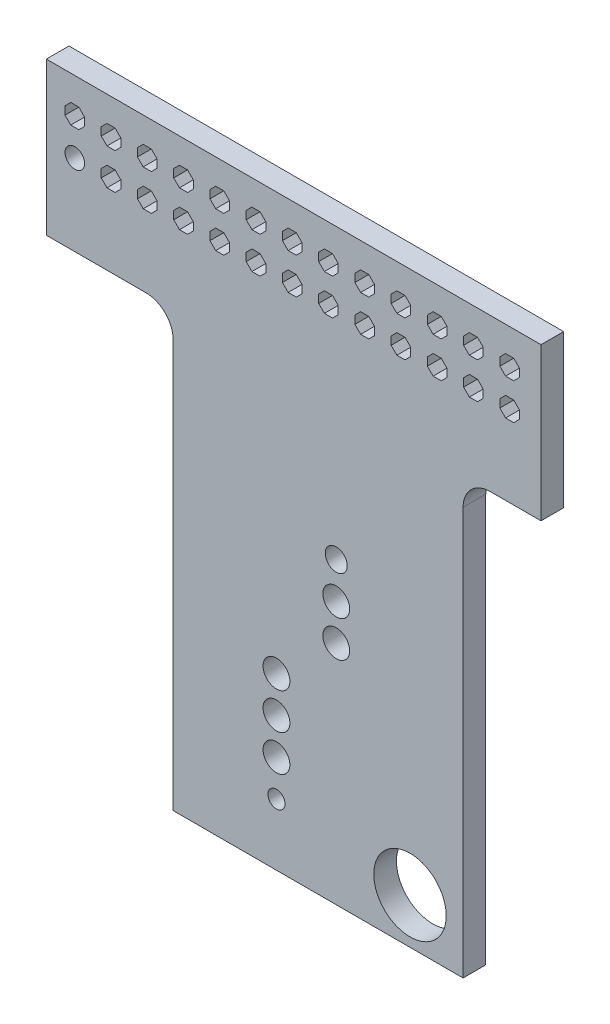
from build123d import *

# Parameters (mm, degrees)
MODEL_R             = 0.599509025
MODEL_R_2           = 0.77087645
MODEL_R_3           = 0.6858
MODEL_R_4           = 0.9398
MODEL_R_5           = 2.54
BOSS_EXTRUDE1_DEPTH = 1.5875


with BuildPart() as part:
    # Model → Boss-Extrude1 (new body)
    with BuildSketch(Plane.XY):
        with BuildLine():
            Line((8.89, 0), (29.21, 0))
            Line((29.21, 0), (29.21, 28.575))
            ThreePointArc((29.21, 28.575), (29.767961582, 29.922038418), (31.115, 30.48))
            Line((31.115, 30.48), (34.671, 30.48))
            Line((34.671, 30.48), (34.671, 41.1734))
            Line((34.671, 41.1734), (0, 41.1734))
            Line((0, 41.1734), (0, 30.48))
            Line((0, 30.48), (6.985, 30.48))
            ThreePointArc((6.985, 30.48), (8.332038418, 29.922038418), (8.89, 28.575))
            Line((8.89, 28.575), (8.89, 0))
        make_face()
        with Locations((16.129, 4.318)):
            Circle(MODEL_R, mode=Mode.SUBTRACT)
        with Locations((20.32, 20.955)):
            Circle(MODEL_R_2, mode=Mode.SUBTRACT)
        with Locations((1.9939, 36.1696)):
            Circle(MODEL_R_3, mode=Mode.SUBTRACT)
        with Locations((20.32, 18.415)):
            Circle(MODEL_R_4, mode=Mode.SUBTRACT)
        with Locations((20.32, 15.875)):
            Circle(MODEL_R_4, mode=Mode.SUBTRACT)
        with Locations((16.129, 6.858)):
            Circle(MODEL_R_4, mode=Mode.SUBTRACT)
        with Locations((16.129, 9.398)):
            Circle(MODEL_R_4, mode=Mode.SUBTRACT)
        with Locations((16.129, 11.938)):
            Circle(MODEL_R_4, mode=Mode.SUBTRACT)
        with Locations((25.4889, 3.175)):
            Circle(MODEL_R_5, mode=Mode.SUBTRACT)
        Polygon((1.3081, 38.425532039), (1.3081, 38.993667961), (1.709832039, 39.3954), (2.277967961, 39.3954), (2.6797, 38.993667961), (2.6797, 38.425532039), (2.277967961, 38.0238), (1.709832039, 38.0238), align=None, mode=Mode.SUBTRACT)
        Polygon((3.8481, 35.885532039), (3.8481, 36.453667961), (4.249832039, 36.8554), (4.817967961, 36.8554), (5.2197, 36.453667961), (5.2197, 35.885532039), (4.817967961, 35.4838), (4.249832039, 35.4838), align=None, mode=Mode.SUBTRACT)
        Polygon((3.8481, 38.425532039), (3.8481, 38.993667961), (4.249832039, 39.3954), (4.817967961, 39.3954), (5.2197, 38.993667961), (5.2197, 38.425532039), (4.817967961, 38.0238), (4.249832039, 38.0238), align=None, mode=Mode.SUBTRACT)
        Polygon((6.3881, 35.885532039), (6.3881, 36.453667961), (6.789832039, 36.8554), (7.357967961, 36.8554), (7.7597, 36.453667961), (7.7597, 35.885532039), (7.357967961, 35.4838), (6.789832039, 35.4838), align=None, mode=Mode.SUBTRACT)
        Polygon((6.3881, 38.425532039), (6.3881, 38.993667961), (6.789832039, 39.3954), (7.357967961, 39.3954), (7.7597, 38.993667961), (7.7597, 38.425532039), (7.357967961, 38.0238), (6.789832039, 38.0238), align=None, mode=Mode.SUBTRACT)
        Polygon((8.9281, 35.885532039), (8.9281, 36.453667961), (9.329832039, 36.8554), (9.897967961, 36.8554), (10.2997, 36.453667961), (10.2997, 35.885532039), (9.897967961, 35.4838), (9.329832039, 35.4838), align=None, mode=Mode.SUBTRACT)
        Polygon((8.9281, 38.425532039), (8.9281, 38.993667961), (9.329832039, 39.3954), (9.897967961, 39.3954), (10.2997, 38.993667961), (10.2997, 38.425532039), (9.897967961, 38.0238), (9.329832039, 38.0238), align=None, mode=Mode.SUBTRACT)
        Polygon((11.4681, 35.885532039), (11.4681, 36.453667961), (11.869832039, 36.8554), (12.437967961, 36.8554), (12.8397, 36.453667961), (12.8397, 35.885532039), (12.437967961, 35.4838), (11.869832039, 35.4838), align=None, mode=Mode.SUBTRACT)
        Polygon((11.4681, 38.425532039), (11.4681, 38.993667961), (11.869832039, 39.3954), (12.437967961, 39.3954), (12.8397, 38.993667961), (12.8397, 38.425532039), (12.437967961, 38.0238), (11.869832039, 38.0238), align=None, mode=Mode.SUBTRACT)
        Polygon((14.0081, 35.885532039), (14.0081, 36.453667961), (14.409832039, 36.8554), (14.977967961, 36.8554), (15.3797, 36.453667961), (15.3797, 35.885532039), (14.977967961, 35.4838), (14.409832039, 35.4838), align=None, mode=Mode.SUBTRACT)
        Polygon((14.0081, 38.425532039), (14.0081, 38.993667961), (14.409832039, 39.3954), (14.977967961, 39.3954), (15.3797, 38.993667961), (15.3797, 38.425532039), (14.977967961, 38.0238), (14.409832039, 38.0238), align=None, mode=Mode.SUBTRACT)
        Polygon((16.5481, 35.885532039), (16.5481, 36.453667961), (16.949832039, 36.8554), (17.517967961, 36.8554), (17.9197, 36.453667961), (17.9197, 35.885532039), (17.517967961, 35.4838), (16.949832039, 35.4838), align=None, mode=Mode.SUBTRACT)
        Polygon((16.5481, 38.425532039), (16.5481, 38.993667961), (16.949832039, 39.3954), (17.517967961, 39.3954), (17.9197, 38.993667961), (17.9197, 38.425532039), (17.517967961, 38.0238), (16.949832039, 38.0238), align=None, mode=Mode.SUBTRACT)
        Polygon((19.0881, 35.885532039), (19.0881, 36.453667961), (19.489832039, 36.8554), (20.057967961, 36.8554), (20.4597, 36.453667961), (20.4597, 35.885532039), (20.057967961, 35.4838), (19.489832039, 35.4838), align=None, mode=Mode.SUBTRACT)
        Polygon((19.0881, 38.425532039), (19.0881, 38.993667961), (19.489832039, 39.3954), (20.057967961, 39.3954), (20.4597, 38.993667961), (20.4597, 38.425532039), (20.057967961, 38.0238), (19.489832039, 38.0238), align=None, mode=Mode.SUBTRACT)
        Polygon((21.6281, 35.885532039), (21.6281, 36.453667961), (22.029832039, 36.8554), (22.597967961, 36.8554), (22.9997, 36.453667961), (22.9997, 35.885532039), (22.597967961, 35.4838), (22.029832039, 35.4838), align=None, mode=Mode.SUBTRACT)
        Polygon((21.6281, 38.425532039), (21.6281, 38.993667961), (22.029832039, 39.3954), (22.597967961, 39.3954), (22.9997, 38.993667961), (22.9997, 38.425532039), (22.597967961, 38.0238), (22.029832039, 38.0238), align=None, mode=Mode.SUBTRACT)
        Polygon((24.1681, 35.885532039), (24.1681, 36.453667961), (24.569832039, 36.8554), (25.137967961, 36.8554), (25.5397, 36.453667961), (25.5397, 35.885532039), (25.137967961, 35.4838), (24.569832039, 35.4838), align=None, mode=Mode.SUBTRACT)
        Polygon((24.1681, 38.425532039), (24.1681, 38.993667961), (24.569832039, 39.3954), (25.137967961, 39.3954), (25.5397, 38.993667961), (25.5397, 38.425532039), (25.137967961, 38.0238), (24.569832039, 38.0238), align=None, mode=Mode.SUBTRACT)
        Polygon((26.7081, 35.885532039), (26.7081, 36.453667961), (27.109832039, 36.8554), (27.677967961, 36.8554), (28.0797, 36.453667961), (28.0797, 35.885532039), (27.677967961, 35.4838), (27.109832039, 35.4838), align=None, mode=Mode.SUBTRACT)
        Polygon((26.7081, 38.425532039), (26.7081, 38.993667961), (27.109832039, 39.3954), (27.677967961, 39.3954), (28.0797, 38.993667961), (28.0797, 38.425532039), (27.677967961, 38.0238), (27.109832039, 38.0238), align=None, mode=Mode.SUBTRACT)
        Polygon((29.2481, 35.885532039), (29.2481, 36.453667961), (29.649832039, 36.8554), (30.217967961, 36.8554), (30.6197, 36.453667961), (30.6197, 35.885532039), (30.217967961, 35.4838), (29.649832039, 35.4838), align=None, mode=Mode.SUBTRACT)
        Polygon((29.2481, 38.425532039), (29.2481, 38.993667961), (29.649832039, 39.3954), (30.217967961, 39.3954), (30.6197, 38.993667961), (30.6197, 38.425532039), (30.217967961, 38.0238), (29.649832039, 38.0238), align=None, mode=Mode.SUBTRACT)
        Polygon((31.7881, 35.885532039), (31.7881, 36.453667961), (32.189832039, 36.8554), (32.757967961, 36.8554), (33.1597, 36.453667961), (33.1597, 35.885532039), (32.757967961, 35.4838), (32.189832039, 35.4838), align=None, mode=Mode.SUBTRACT)
        Polygon((31.7881, 38.425532039), (31.7881, 38.993667961), (32.189832039, 39.3954), (32.757967961, 39.3954), (33.1597, 38.993667961), (33.1597, 38.425532039), (32.757967961, 38.0238), (32.189832039, 38.0238), align=None, mode=Mode.SUBTRACT)
    extrude(amount=BOSS_EXTRUDE1_DEPTH)


solid = part.part
